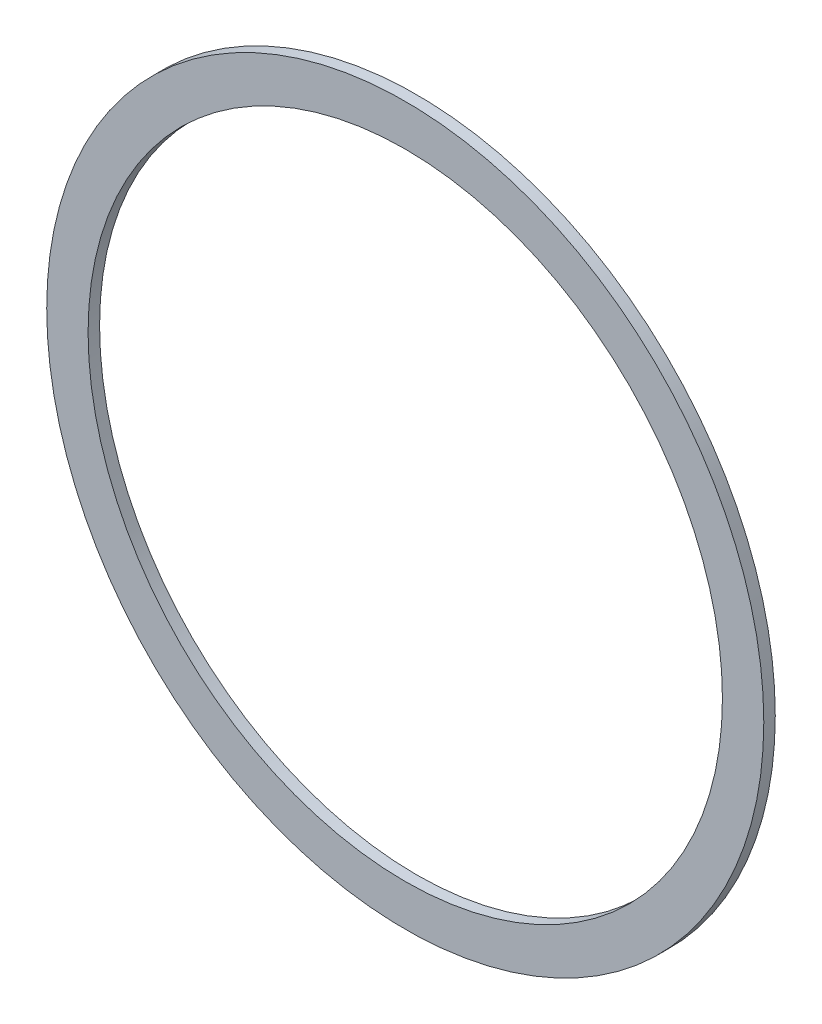
from build123d import *

# Parameters (mm, degrees)
SKETCH_1_R      = 15.6
SKETCH_1_R_2    = 13.8
EXTRUDE_1_DEPTH = 0.5


with BuildPart() as part:
    # 草图1 → 拉伸-薄壁1 (new body)
    with BuildSketch(Plane.XY):
        Circle(SKETCH_1_R)
        Circle(SKETCH_1_R_2, mode=Mode.SUBTRACT)
    extrude(amount=EXTRUDE_1_DEPTH)


solid = part.part
